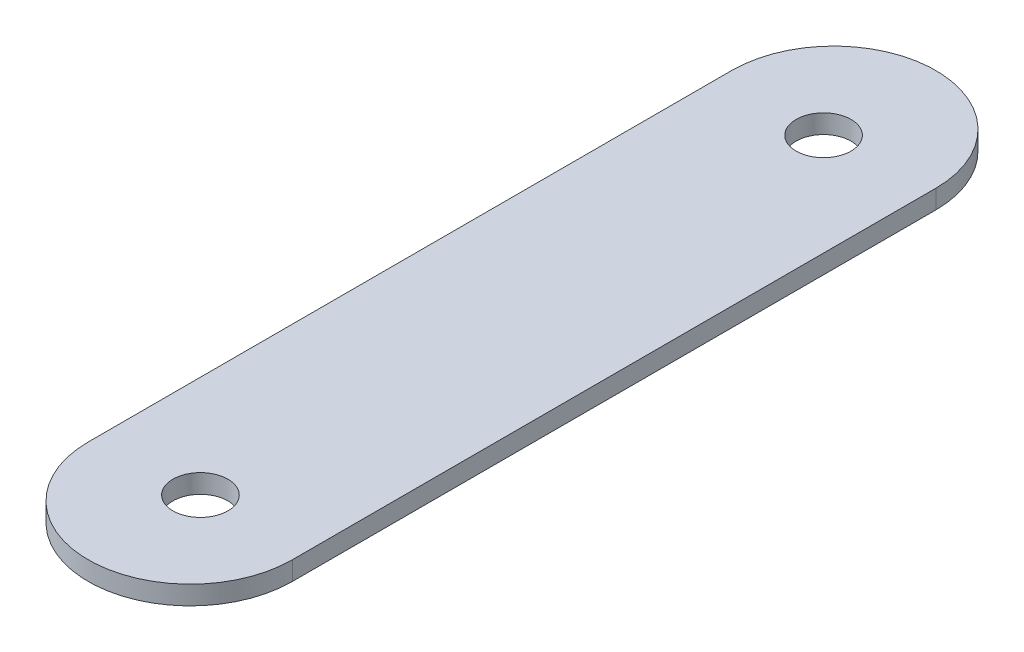
from build123d import *

# Parameters (mm, degrees)
SKETCH_1_R      = 1.75
EXTRUDE_1_DEPTH = 1.2


with BuildPart() as part:
    # 草图1 → 凸台-拉伸1 (new body)
    with BuildSketch(Plane.XZ):
        with BuildLine():
            Line((6.5, -20.5), (6.5, 20.5))
            ThreePointArc((6.5, 20.5), (0, 27), (-6.5, 20.5))
            Line((-6.5, 20.5), (-6.5, -20.5))
            ThreePointArc((-6.5, -20.5), (0, -27), (6.5, -20.5))
        make_face()
        with Locations(Location((0, 19.85, 0), (0, 0, 90))):
            Circle(SKETCH_1_R, mode=Mode.SUBTRACT)
        with Locations(Location((0, -19.85, 0), (0, 0, 90))):
            Circle(SKETCH_1_R, mode=Mode.SUBTRACT)
    extrude(amount=-EXTRUDE_1_DEPTH)


solid = part.part
